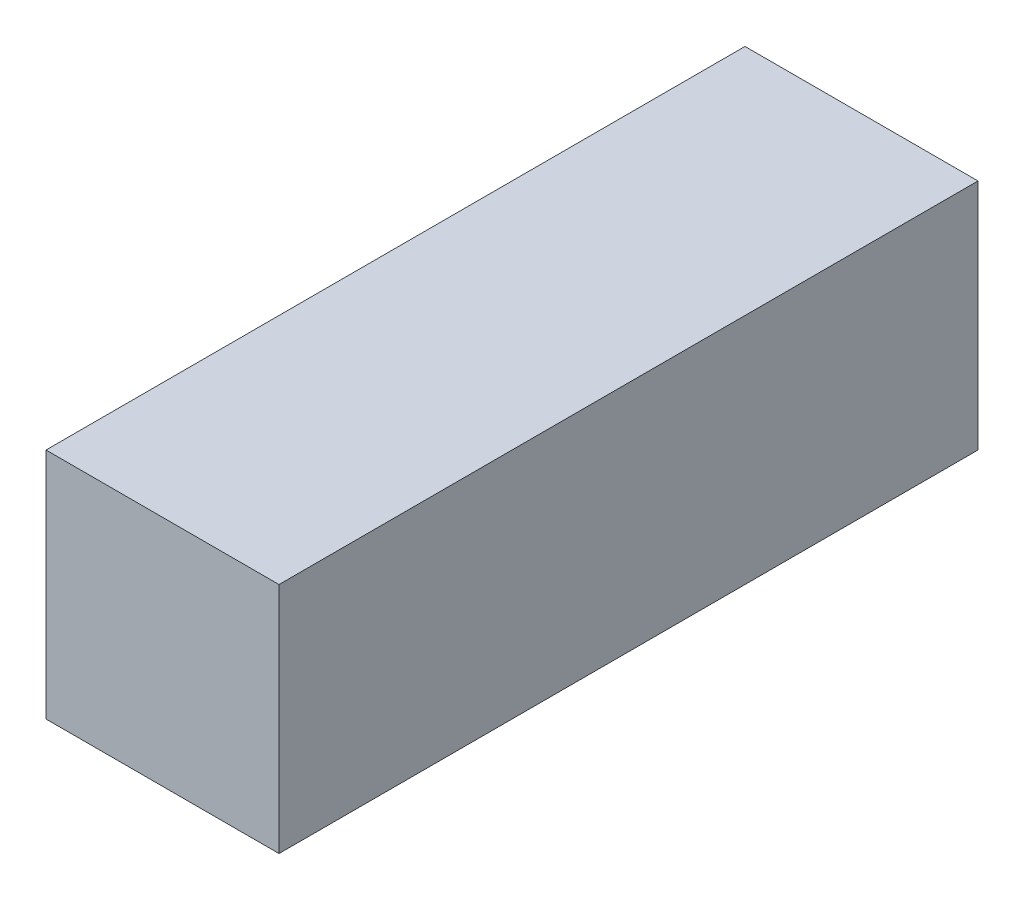
from build123d import *

# Parameters (mm, degrees)
SKETCH_1_W      = 10
SKETCH_1_H      = 10
EXTRUDE_1_DEPTH = 30


with BuildPart() as part:
    # 草图1 → 凸台-拉伸1 (new body)
    with BuildSketch(Plane.XY):
        with Locations((5, 5)):
            Rectangle(SKETCH_1_W, SKETCH_1_H)
    extrude(amount=EXTRUDE_1_DEPTH)


solid = part.part
